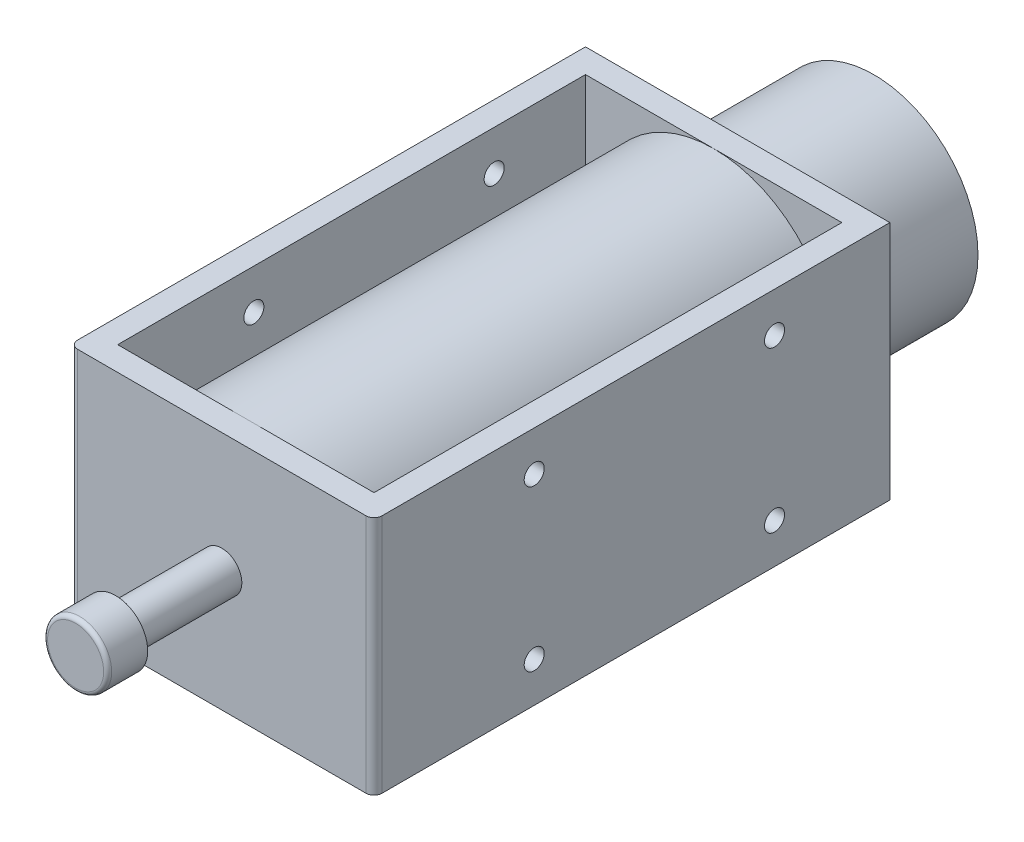
from build123d import *

# Parameters (mm, degrees)
SKETCH1_W                 = 38
SKETCH1_H                 = 30
BOSS_EXTRUDE1_DEPTH       = 64.4
SKETCH3_R                 = 13
BOSS_EXTRUDE3_DEPTH       = 17
SKETCH2_R                 = 4
BOSS_EXTRUDE4_DEPTH       = 18.25
SKETCH16_W                = 32
SKETCH16_H                = 58.4
CUT_EXTRUDE1_DEPTH        = 90.955669638
SKETCH17_R                = 15
BOSS_EXTRUDE9_DEPTH       = 58.4
FILLET1_R                 = 1
M3X0_5_TAPPED_HOLE1_D     = 2.5
M3X0_5_TAPPED_HOLE1_DEPTH = 3
M3X0_5_TAPPED_HOLE2_D     = 2.5
M3X0_5_TAPPED_HOLE2_DEPTH = 3
SKETCH22_R                = 4
SKETCH22_R_2              = 2.5
CUT_EXTRUDE2_DEPTH        = 13.25
FILLET2_R                 = 0.5


with BuildPart() as part:
    # Sketch1 → Boss-Extrude1 (new body)
    with BuildSketch(Plane.XY):
        Rectangle(SKETCH1_W, SKETCH1_H)
    extrude(amount=BOSS_EXTRUDE1_DEPTH)

    # Sketch3 → Boss-Extrude3 (add)
    with BuildSketch(Plane(origin=(0, 0, 0), x_dir=(-1, 0, 0), z_dir=(0, 0, -1))):
        Circle(SKETCH3_R)
    extrude(amount=BOSS_EXTRUDE3_DEPTH)

    # Sketch2 → Boss-Extrude4 (add)
    with BuildSketch(Plane.XY.offset(64.4)):
        with Locations(Location((0, 0, 0), (0, 0, 180))):
            Circle(SKETCH2_R)
    extrude(amount=BOSS_EXTRUDE4_DEPTH)

    # Sketch16 → Cut-Extrude1 (cut, through all)
    with BuildSketch(Plane.XZ.offset(15)):
        with Locations((0, 32.2)):
            Rectangle(SKETCH16_W, SKETCH16_H)
    extrude(amount=-CUT_EXTRUDE1_DEPTH, mode=Mode.SUBTRACT)

    # Sketch17 → Boss-Extrude9 (add)
    with BuildSketch(Plane(origin=(0, 0, 61.4), x_dir=(-1, 0, 0), z_dir=(0, 0, -1))):
        with Locations(Location((0, 0, 0), (0, 0, 270))):
            Circle(SKETCH17_R)
    extrude(amount=BOSS_EXTRUDE9_DEPTH)

    # Fillet1
    fillet1_edges = [part.edges().sort_by_distance(p)[0] for p in [
        (-19, 0, 64.4),
        (19, 0, 64.4),
    ]]
    fillet(fillet1_edges, radius=FILLET1_R)

    # M3x0.5 Tapped Hole1
    with Locations(Plane.ZY.offset(19)):
        with Locations((14.4, -10), (44.4, -10), (44.4, 10), (14.4, 10)):
            Hole(M3X0_5_TAPPED_HOLE1_D / 2, depth=M3X0_5_TAPPED_HOLE1_DEPTH)

    # M3x0.5 Tapped Hole2
    with Locations(Plane(origin=(19, 0, 0), x_dir=(0, 0, -1), z_dir=(1, 0, 0))):
        with Locations((-14.4, 10), (-14.4, -10), (-44.4, -10), (-44.4, 10)):
            Hole(M3X0_5_TAPPED_HOLE2_D / 2, depth=M3X0_5_TAPPED_HOLE2_DEPTH)

    # Sketch22 → Cut-Extrude2 (cut)
    with BuildSketch(Plane.XY.offset(64.4)):
        Circle(SKETCH22_R)
        Circle(SKETCH22_R_2, mode=Mode.SUBTRACT)
    extrude(amount=CUT_EXTRUDE2_DEPTH, mode=Mode.SUBTRACT)

    # Fillet2
    fillet2_edges = [part.edges().sort_by_distance(p)[0] for p in [
        (4, 0, 82.65),
    ]]
    fillet(fillet2_edges, radius=FILLET2_R)


solid = part.part
